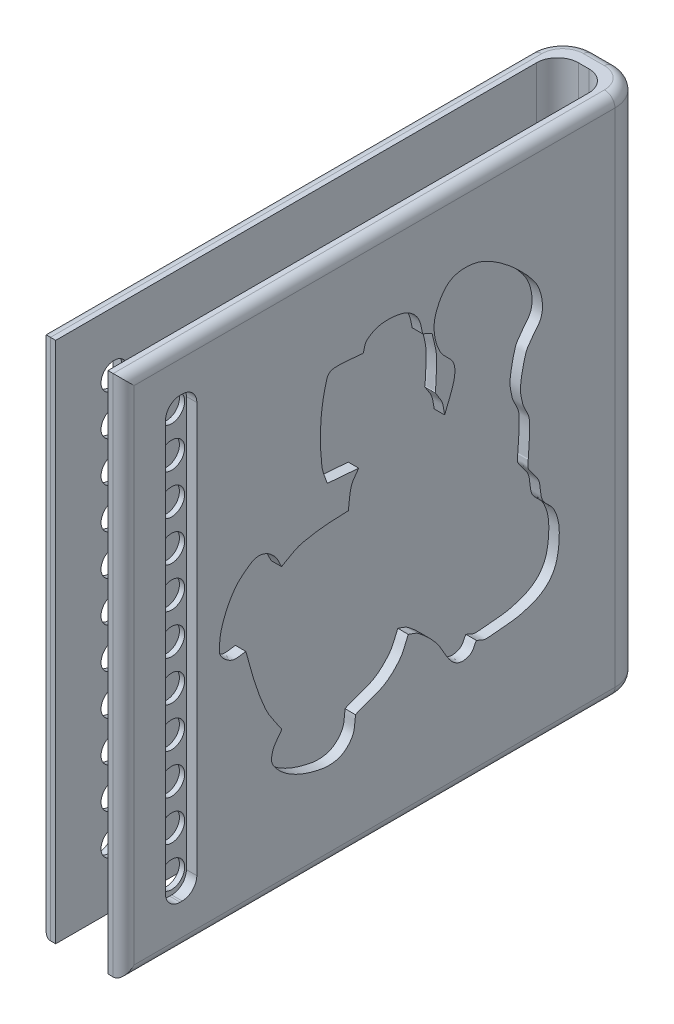
from build123d import *

# Parameters (mm, degrees)
SKETCH1_W                = 4
SKETCH1_H                = 25
BOSS_EXTRUDE1_DEPTH      = 25
SKETCH2_W                = 2.5
SKETCH2_H                = 25
CUT_EXTRUDE1_DEPTH       = 24
FILLET2_R                = 1
CUT_EXTRUDE2_DEPTH       = 0.5
CUT_EXTRUDE3_REACH       = 30.169
SKETCH4_R                = 0.625
LPATTERN1_COUNT          = 6
LPATTERN1_PITCH          = 1.93
LPATTERN1_COL_COUNT      = 6
LPATTERN1_COL_PITCH      = 1.93
MIRROR1_COPY_1_REACH     = 30.169
MIRROR1_COPY_1_SKETCH_R  = 0.625
MIRROR1_COPY_2_REACH     = 30.169
MIRROR1_COPY_2_SKETCH_R  = 0.625
MIRROR1_COPY_3_REACH     = 30.169
MIRROR1_COPY_3_SKETCH_R  = 0.625
MIRROR1_COPY_4_REACH     = 30.169
MIRROR1_COPY_4_SKETCH_R  = 0.625
MIRROR1_COPY_5_REACH     = 30.169
MIRROR1_COPY_5_SKETCH_R  = 0.625
MIRROR1_COPY_6_REACH     = 30.169
MIRROR1_COPY_6_SKETCH_R  = 0.625
MIRROR1_COPY_7_REACH     = 30.169
MIRROR1_COPY_7_SKETCH_R  = 0.625
MIRROR1_COPY_8_REACH     = 30.169
MIRROR1_COPY_8_SKETCH_R  = 0.625
MIRROR1_COPY_9_REACH     = 30.169
MIRROR1_COPY_9_SKETCH_R  = 0.625
MIRROR1_COPY_10_REACH    = 30.169
MIRROR1_COPY_10_SKETCH_R = 0.625
CUT_EXTRUDE4_START       = 2
CUT_EXTRUDE4_DEPTH       = 0.5
FILLET3_R                = 1.5
FILLET4_R                = 0.5


with BuildPart() as part:
    # Sketch1 → Boss-Extrude1 (new body)
    with BuildSketch(Plane.XY):
        Rectangle(SKETCH1_W, SKETCH1_H)
    extrude(amount=BOSS_EXTRUDE1_DEPTH)

    # Sketch2 → Cut-Extrude1 (cut)
    with BuildSketch(Plane.XY.offset(25)):
        Rectangle(SKETCH2_W, SKETCH2_H)
    extrude(amount=-CUT_EXTRUDE1_DEPTH, mode=Mode.SUBTRACT)

    # Fillet2
    fillet2_edges = [part.edges().sort_by_distance(p)[0] for p in [
        (-1.25, 0, 1),
        (1.25, 0, 1),
    ]]
    fillet(fillet2_edges, radius=FILLET2_R)

    # Sketch3 → Cut-Extrude2 (cut)
    with BuildSketch(Plane.ZY.offset(2)):
        with BuildLine():
            Line((22.3, 10.5), (22.2, 10.5))
            ThreePointArc((22.2, 10.5), (21.705025253, 10.294974747), (21.5, 9.8))
            Line((21.5, 9.8), (21.5, -9.8))
            ThreePointArc((21.5, -9.8), (21.705025253, -10.294974747), (22.2, -10.5))
            Line((22.2, -10.5), (22.3, -10.5))
            ThreePointArc((22.3, -10.5), (22.794974747, -10.294974747), (23, -9.8))
            Line((23, -9.8), (23, 9.8))
            ThreePointArc((23, 9.8), (22.794974747, 10.294974747), (22.3, 10.5))
        make_face()
    cut_extrude2 = extrude(amount=-CUT_EXTRUDE2_DEPTH, mode=Mode.SUBTRACT)

    # Sketch4 → Cut-Extrude3 (cut, up to next)
    with BuildSketch(Plane.ZY.offset(1.5), mode=Mode.PRIVATE) as cut_extrude3_sk1:
        with Locations((22.206617043, 0)):
            Circle(SKETCH4_R)
    cut_extrude3_tool1 = extrude(cut_extrude3_sk1.sketch, amount=-CUT_EXTRUDE3_REACH, mode=Mode.PRIVATE) & part.part
    cut_extrude3 = cut_extrude3_tool1.solids().sort_by_distance((-1.5, 0, 22.206617))[0]
    add(cut_extrude3, mode=Mode.SUBTRACT)

    # LPattern1: Cut-Extrude3 ×6
    with Locations(*[(0, -i * LPATTERN1_PITCH, 0) for i in range(1, LPATTERN1_COUNT)]):
        add(cut_extrude3, mode=Mode.SUBTRACT)

    # LPattern1 col: Cut-Extrude3 ×6
    with Locations(*[(0, i * LPATTERN1_COL_PITCH, 0) for i in range(1, LPATTERN1_COL_COUNT)]):
        add(cut_extrude3, mode=Mode.SUBTRACT)

    # Mirror1: Cut-Extrude2, Cut-Extrude3 across plane
    add(cut_extrude2.mirror(Plane(origin=(0, 0, 0), x_dir=(0, 0, 1), z_dir=(1, 0, 0))), mode=Mode.SUBTRACT)
    add(cut_extrude3.mirror(Plane(origin=(0, 0, 0), x_dir=(0, 0, 1), z_dir=(1, 0, 0))), mode=Mode.SUBTRACT)

    # Mirror1 copy 1 sketch → Mirror1 copy 1 (cut, up to next)
    with BuildSketch(Plane(origin=(1.5, -1.93, 0), x_dir=(0, 0, 1), z_dir=(1, 0, 0)), mode=Mode.PRIVATE) as mirror1_copy_1_sk1:
        with Locations((22.206617043, 0)):
            Circle(MIRROR1_COPY_1_SKETCH_R)
    mirror1_copy_1_tool1 = extrude(mirror1_copy_1_sk1.sketch, amount=-MIRROR1_COPY_1_REACH, mode=Mode.PRIVATE) & part.part
    add(mirror1_copy_1_tool1.solids().sort_by_distance((1.5, -1.93, 22.206617))[0], mode=Mode.SUBTRACT)

    # Mirror1 copy 2 sketch → Mirror1 copy 2 (cut, up to next)
    with BuildSketch(Plane(origin=(1.5, -3.86, 0), x_dir=(0, 0, 1), z_dir=(1, 0, 0)), mode=Mode.PRIVATE) as mirror1_copy_2_sk1:
        with Locations((22.206617043, 0)):
            Circle(MIRROR1_COPY_2_SKETCH_R)
    mirror1_copy_2_tool1 = extrude(mirror1_copy_2_sk1.sketch, amount=-MIRROR1_COPY_2_REACH, mode=Mode.PRIVATE) & part.part
    add(mirror1_copy_2_tool1.solids().sort_by_distance((1.5, -3.86, 22.206617))[0], mode=Mode.SUBTRACT)

    # Mirror1 copy 3 sketch → Mirror1 copy 3 (cut, up to next)
    with BuildSketch(Plane(origin=(1.5, -5.79, 0), x_dir=(0, 0, 1), z_dir=(1, 0, 0)), mode=Mode.PRIVATE) as mirror1_copy_3_sk1:
        with Locations((22.206617043, 0)):
            Circle(MIRROR1_COPY_3_SKETCH_R)
    mirror1_copy_3_tool1 = extrude(mirror1_copy_3_sk1.sketch, amount=-MIRROR1_COPY_3_REACH, mode=Mode.PRIVATE) & part.part
    add(mirror1_copy_3_tool1.solids().sort_by_distance((1.5, -5.79, 22.206617))[0], mode=Mode.SUBTRACT)

    # Mirror1 copy 4 sketch → Mirror1 copy 4 (cut, up to next)
    with BuildSketch(Plane(origin=(1.5, -7.72, 0), x_dir=(0, 0, 1), z_dir=(1, 0, 0)), mode=Mode.PRIVATE) as mirror1_copy_4_sk1:
        with Locations((22.206617043, 0)):
            Circle(MIRROR1_COPY_4_SKETCH_R)
    mirror1_copy_4_tool1 = extrude(mirror1_copy_4_sk1.sketch, amount=-MIRROR1_COPY_4_REACH, mode=Mode.PRIVATE) & part.part
    add(mirror1_copy_4_tool1.solids().sort_by_distance((1.5, -7.72, 22.206617))[0], mode=Mode.SUBTRACT)

    # Mirror1 copy 5 sketch → Mirror1 copy 5 (cut, up to next)
    with BuildSketch(Plane(origin=(1.5, -9.65, 0), x_dir=(0, 0, 1), z_dir=(1, 0, 0)), mode=Mode.PRIVATE) as mirror1_copy_5_sk1:
        with Locations((22.206617043, 0)):
            Circle(MIRROR1_COPY_5_SKETCH_R)
    mirror1_copy_5_tool1 = extrude(mirror1_copy_5_sk1.sketch, amount=-MIRROR1_COPY_5_REACH, mode=Mode.PRIVATE) & part.part
    add(mirror1_copy_5_tool1.solids().sort_by_distance((1.5, -9.65, 22.206617))[0], mode=Mode.SUBTRACT)

    # Mirror1 copy 6 sketch → Mirror1 copy 6 (cut, up to next)
    with BuildSketch(Plane(origin=(1.5, 1.93, 0), x_dir=(0, 0, 1), z_dir=(1, 0, 0)), mode=Mode.PRIVATE) as mirror1_copy_6_sk1:
        with Locations((22.206617043, 0)):
            Circle(MIRROR1_COPY_6_SKETCH_R)
    mirror1_copy_6_tool1 = extrude(mirror1_copy_6_sk1.sketch, amount=-MIRROR1_COPY_6_REACH, mode=Mode.PRIVATE) & part.part
    add(mirror1_copy_6_tool1.solids().sort_by_distance((1.5, 1.93, 22.206617))[0], mode=Mode.SUBTRACT)

    # Mirror1 copy 7 sketch → Mirror1 copy 7 (cut, up to next)
    with BuildSketch(Plane(origin=(1.5, 3.86, 0), x_dir=(0, 0, 1), z_dir=(1, 0, 0)), mode=Mode.PRIVATE) as mirror1_copy_7_sk1:
        with Locations((22.206617043, 0)):
            Circle(MIRROR1_COPY_7_SKETCH_R)
    mirror1_copy_7_tool1 = extrude(mirror1_copy_7_sk1.sketch, amount=-MIRROR1_COPY_7_REACH, mode=Mode.PRIVATE) & part.part
    add(mirror1_copy_7_tool1.solids().sort_by_distance((1.5, 3.86, 22.206617))[0], mode=Mode.SUBTRACT)

    # Mirror1 copy 8 sketch → Mirror1 copy 8 (cut, up to next)
    with BuildSketch(Plane(origin=(1.5, 5.79, 0), x_dir=(0, 0, 1), z_dir=(1, 0, 0)), mode=Mode.PRIVATE) as mirror1_copy_8_sk1:
        with Locations((22.206617043, 0)):
            Circle(MIRROR1_COPY_8_SKETCH_R)
    mirror1_copy_8_tool1 = extrude(mirror1_copy_8_sk1.sketch, amount=-MIRROR1_COPY_8_REACH, mode=Mode.PRIVATE) & part.part
    add(mirror1_copy_8_tool1.solids().sort_by_distance((1.5, 5.79, 22.206617))[0], mode=Mode.SUBTRACT)

    # Mirror1 copy 9 sketch → Mirror1 copy 9 (cut, up to next)
    with BuildSketch(Plane(origin=(1.5, 7.72, 0), x_dir=(0, 0, 1), z_dir=(1, 0, 0)), mode=Mode.PRIVATE) as mirror1_copy_9_sk1:
        with Locations((22.206617043, 0)):
            Circle(MIRROR1_COPY_9_SKETCH_R)
    mirror1_copy_9_tool1 = extrude(mirror1_copy_9_sk1.sketch, amount=-MIRROR1_COPY_9_REACH, mode=Mode.PRIVATE) & part.part
    add(mirror1_copy_9_tool1.solids().sort_by_distance((1.5, 7.72, 22.206617))[0], mode=Mode.SUBTRACT)

    # Mirror1 copy 10 sketch → Mirror1 copy 10 (cut, up to next)
    with BuildSketch(Plane(origin=(1.5, 9.65, 0), x_dir=(0, 0, 1), z_dir=(1, 0, 0)), mode=Mode.PRIVATE) as mirror1_copy_10_sk1:
        with Locations((22.206617043, 0)):
            Circle(MIRROR1_COPY_10_SKETCH_R)
    mirror1_copy_10_tool1 = extrude(mirror1_copy_10_sk1.sketch, amount=-MIRROR1_COPY_10_REACH, mode=Mode.PRIVATE) & part.part
    add(mirror1_copy_10_tool1.solids().sort_by_distance((1.5, 9.65, 22.206617))[0], mode=Mode.SUBTRACT)

    # Sketch6 → Cut-Extrude4 (cut)
    with BuildSketch(Plane(origin=(0, 0, 0), x_dir=(0, 0, -1), z_dir=(1, 0, 0)).offset(CUT_EXTRUDE4_START)):
        with BuildLine():
            Line((-13.75659598, 3.208094703), (-15.25659598, 3.328094703))
            add(Edge.make_bspline(
                [(-15.25659598, 3.328094703), (-15.34159598, 3.598094703), (-15.478059231, 3.857024807), (-15.51159598, 4.138094703), (-15.583906266, 4.744123764), (-15.610639421, 5.359017032), (-15.57159598, 5.968094703), (-15.535260245, 6.534932171), (-15.444836525, 7.102581248), (-15.28659598, 7.648094703), (-15.249167055, 7.777126), (-15.134978357, 7.91699683), (-15.00159598, 7.933094703), (-14.519450844, 7.991284633), (-14.03159598, 7.883094703), (-13.54659598, 7.858094703)],
                knots=[0, 0, 0, 0, 1, 1, 1, 2, 2, 2, 3, 3, 3, 4, 4, 4, 5, 5, 5, 5], degree=3))
            add(Edge.make_bspline(
                [(-13.54659598, 7.858094703), (-13.48159598, 8.013094703), (-13.476741249, 8.210895497), (-13.35159598, 8.323094703), (-13.166723721, 8.488842246), (-12.922480212, 8.603584636), (-12.67659598, 8.638094703), (-12.334048727, 8.686171511), (-11.974306488, 8.657718792), (-11.64159598, 8.563094703), (-11.412157478, 8.497841551), (-11.197922131, 8.353267216), (-11.04159598, 8.173094703), (-10.804491339, 7.899821558), (-10.762009421, 7.570161907), (-10.69659598, 7.243094703)],
                knots=[0, 0, 0, 0, 1, 1, 1, 2, 2, 2, 3, 3, 3, 4, 4, 4, 5, 5, 5, 5], degree=3))
            Line((-10.69659598, 7.243094703), (-10.24659598, 7.033094703))
            add(Edge.make_bspline(
                [(-10.24659598, 7.033094703), (-10.17659598, 6.693094703), (-10.059548306, 6.359466167), (-10.03659598, 6.013094703), (-10.004181978, 5.523937947), (-10.062196157, 5.032940237), (-10.08159598, 4.543094703), (-10.082221683, 4.5272957), (-10.10394565, 4.512094073), (-10.09659598, 4.498094703), (-9.99654865, 4.307528359), (-9.845622127, 4.143294274), (-9.76659598, 3.943094703), (-9.693507703, 3.757937733), (-9.68659598, 3.553094703), (-9.64659598, 3.358094703)],
                knots=[0, 0, 0, 0, 1, 1, 1, 2, 2, 2, 3, 3, 3, 4, 4, 4, 5, 5, 5, 5], degree=3))
            add(Edge.make_bspline(
                [(-9.64659598, 3.358094703), (-9.49659598, 3.768094703), (-9.288520046, 4.161304396), (-9.19659598, 4.588094703), (-9.146018675, 4.822917905), (-9.129038173, 5.088589637), (-9.22659598, 5.308094703), (-9.360760059, 5.60996388), (-9.700743832, 5.781830033), (-9.85659598, 6.073094703), (-10.011822034, 6.363189295), (-10.108585544, 6.690741208), (-10.14159598, 7.018094703), (-10.169907425, 7.298849867), (-10.138982996, 7.595146231), (-10.03659598, 7.858094703), (-9.913309024, 8.174718023), (-9.742862161, 8.495862148), (-9.48159598, 8.713094703), (-9.271261927, 8.887979197), (-8.975049206, 8.961142503), (-8.70159598, 8.968094703), (-8.364362395, 8.976668438), (-8.017342873, 8.900638863), (-7.71159598, 8.758094703), (-7.264149639, 8.549487963), (-6.857104165, 8.253592134), (-6.48159598, 7.933094703), (-6.067318292, 7.579507377), (-5.679685309, 7.186573078), (-5.35659598, 6.748094703), (-5.182509496, 6.511834474), (-5.069657746, 6.22576436), (-5.01159598, 5.938094703), (-4.957179545, 5.668486002), (-4.938146197, 5.373530177), (-5.02659598, 5.113094703), (-5.126052852, 4.82024947), (-5.382439364, 4.607007892), (-5.55159598, 4.348094703), (-5.627580506, 4.231791858), (-5.72326723, 4.121627122), (-5.76159598, 3.988094703), (-5.879821683, 3.576211609), (-5.985172366, 3.155455858), (-6.01659598, 2.728094703), (-6.035834132, 2.466455842), (-5.979192538, 2.201581794), (-5.91159598, 1.948094703), (-5.838150825, 1.67267537), (-5.628462394, 1.43635171), (-5.59659598, 1.153094703), (-5.536762273, 0.621239528), (-5.622321636, 0.082957769), (-5.64159598, -0.451905297), (-5.6423384, -0.472507452), (-5.65659598, -0.491289769), (-5.65659598, -0.511905297), (-5.65659598, -0.632009418), (-5.692304606, -0.763030895), (-5.64159598, -0.871905297), (-5.51688444, -1.139668311), (-5.2593142, -1.333876721), (-5.14659598, -1.606905297), (-5.029848014, -1.889694816), (-5.095826647, -2.229597824), (-4.96659598, -2.506905297), (-4.848153364, -2.76106341), (-4.555883166, -2.903088449), (-4.42659598, -3.151905297), (-4.285044038, -3.424326015), (-4.192864316, -3.730641264), (-4.17159598, -4.036905297), (-4.142053328, -4.462319485), (-4.174624176, -4.89783797), (-4.27659598, -5.311905297), (-4.342917918, -5.581212557), (-4.479525035, -5.842138451), (-4.66659598, -6.046905297), (-4.861147332, -6.259860155), (-5.118927955, -6.419416562), (-5.38659598, -6.526905297), (-5.763597062, -6.678299432), (-6.166720467, -6.778352077), (-6.57159598, -6.811905297), (-7.789953763, -6.912874174), (-7.65215886, -6.976623857), (-8.13159598, -6.736905297)],
                knots=[0, 0, 0, 0, 1, 1, 1, 2, 2, 2, 3, 3, 3, 4, 4, 4, 5, 5, 5, 6, 6, 6, 7, 7, 7, 8, 8, 8, 9, 9, 9, 10, 10, 10, 11, 11, 11, 12, 12, 12, 13, 13, 13, 14, 14, 14, 15, 15, 15, 16, 16, 16, 17, 17, 17, 18, 18, 18, 19, 19, 19, 20, 20, 20, 21, 21, 21, 22, 22, 22, 23, 23, 23, 24, 24, 24, 25, 25, 25, 26, 26, 26, 27, 27, 27, 28, 28, 28, 29, 29, 29, 29], degree=3))
            add(Edge.make_bspline(
                [(-8.13159598, -6.736905297), (-8.22159598, -6.876905297), (-8.26436961, -7.062730336), (-8.40159598, -7.156905297), (-8.540667701, -7.252346674), (-8.730903679, -7.293465735), (-8.89659598, -7.261905297), (-9.071012952, -7.228683016), (-9.23263856, -7.113062215), (-9.34659598, -6.976905297), (-9.625216523, -6.644008025), (-9.778150445, -6.219066296), (-10.05159598, -5.881905297), (-10.29661073, -5.579799732), (-10.582513679, -5.308058067), (-10.89159598, -5.071905297), (-11.034017705, -4.963088698), (-11.22159598, -4.931905297), (-11.38659598, -4.861905297)],
                knots=[0, 0, 0, 0, 1, 1, 1, 2, 2, 2, 3, 3, 3, 4, 4, 4, 5, 5, 5, 6, 6, 6, 6], degree=3))
            add(Edge.make_bspline(
                [(-11.38659598, -4.861905297), (-11.51659598, -5.131905297), (-11.594914061, -5.433595246), (-11.77659598, -5.671905297), (-11.986836337, -5.947675115), (-12.243642088, -6.199497636), (-12.54159598, -6.376905297), (-12.910187156, -6.596371798), (-13.344206699, -6.680329435), (-13.74159598, -6.841905297), (-13.799631993, -6.865502357), (-13.85159598, -6.901905297), (-13.90659598, -6.931905297)],
                knots=[0, 0, 0, 0, 1, 1, 1, 2, 2, 2, 3, 3, 3, 4, 4, 4, 4], degree=3))
            add(Edge.make_bspline(
                [(-13.90659598, -6.931905297), (-13.95659598, -7.201905297), (-13.926412623, -7.500136205), (-14.05659598, -7.741905297), (-14.184030979, -7.978570294), (-14.392540831, -8.195803702), (-14.64159598, -8.296905297), (-14.929428763, -8.413748308), (-15.26647199, -8.415209244), (-15.57159598, -8.356905297), (-16.067135074, -8.262216298), (-16.56050565, -8.100578757), (-16.99659598, -7.846905297), (-17.342055911, -7.645951481), (-17.662556052, -7.365551492), (-17.86659598, -7.021905297), (-17.971287551, -6.845582652), (-17.919234057, -6.600490138), (-17.85159598, -6.406905297), (-17.768347183, -6.168641498), (-17.57159598, -5.986905297), (-17.43159598, -5.776905297)],
                knots=[0, 0, 0, 0, 1, 1, 1, 2, 2, 2, 3, 3, 3, 4, 4, 4, 5, 5, 5, 6, 6, 6, 7, 7, 7, 7], degree=3))
            add(Edge.make_bspline(
                [(-17.43159598, -5.776905297), (-17.68659598, -5.376905297), (-17.996656257, -5.007078642), (-18.19659598, -4.576905297), (-18.625110168, -3.65495053), (-18.894637192, -2.664250752), (-19.15659598, -1.681905297)],
                knots=[0, 0, 0, 0, 1, 1, 1, 2, 2, 2, 2], degree=3))
            add(Edge.make_bspline(
                [(-19.15659598, -1.681905297), (-19.36159598, -1.696905297), (-19.57154848, -1.774138734), (-19.77159598, -1.726905297), (-19.95111846, -1.684518045), (-20.106164006, -1.557337271), (-20.23659598, -1.426905297), (-20.328315662, -1.335185615), (-20.412413923, -1.21154908), (-20.41659598, -1.081905297), (-20.42797332, -0.729207755), (-20.389799692, -0.367787652), (-20.28159598, -0.031905297), (-20.146522308, 0.387385894), (-19.953456189, 0.795222053), (-19.69659598, 1.153094703), (-19.500477146, 1.426338922), (-19.224266505, 1.638294598), (-18.94659598, 1.828094703), (-18.82125706, 1.913769408), (-18.663240825, 1.970432357), (-18.51159598, 1.963094703), (-18.336230654, 1.954609284), (-18.156508924, 1.889157741), (-18.01659598, 1.783094703), (-17.681073904, 1.528747323), (-17.601852143, 1.300857713), (-17.44659598, 0.973094703)],
                knots=[0, 0, 0, 0, 1, 1, 1, 2, 2, 2, 3, 3, 3, 4, 4, 4, 5, 5, 5, 6, 6, 6, 7, 7, 7, 8, 8, 8, 9, 9, 9, 9], degree=3))
            add(Edge.make_bspline(
                [(-17.44659598, 0.973094703), (-17.14159598, 1.128094703), (-16.862138601, 1.349824799), (-16.53159598, 1.438094703), (-15.792748628, 1.63540053), (-15.016055345, 1.672433639), (-14.25159598, 1.693094703)],
                knots=[0, 0, 0, 0, 1, 1, 1, 2, 2, 2, 2], degree=3))
            add(Edge.make_bspline(
                [(-14.25159598, 1.693094703), (-14.20159598, 2.018094703), (-14.203720501, 2.355531778), (-14.10159598, 2.668094703), (-14.035257059, 2.871132009), (-13.87159598, 3.028094703), (-13.75659598, 3.208094703)],
                knots=[0, 0, 0, 0, 1, 1, 1, 2, 2, 2, 2], degree=3))
        make_face()
    extrude(amount=-CUT_EXTRUDE4_DEPTH, mode=Mode.SUBTRACT)

    # Fillet3
    fillet3_edges = [part.edges().sort_by_distance(p)[0] for p in [
        (2, 0, 0),
        (-2, 0, 0),
    ]]
    fillet(fillet3_edges, radius=FILLET3_R)

    # Fillet4
    fillet4_edges = [part.edges().sort_by_distance(p)[0] for p in [
        (2, 0, 25),
        (0, -12.5, 0),
        (1.560660172, -12.5, 0.439339828),
        (-1.560660172, -12.5, 0.439339828),
        (0, 12.5, 0),
        (1.560660172, 12.5, 0.439339828),
        (-1.560660172, 12.5, 0.439339828),
        (-2, 0, 25),
        (-2, 12.5, 13.25),
        (2, 12.5, 13.25),
        (2, -12.5, 13.25),
        (-2, -12.5, 13.25),
    ]]
    fillet(fillet4_edges, radius=FILLET4_R)


solid = part.part
